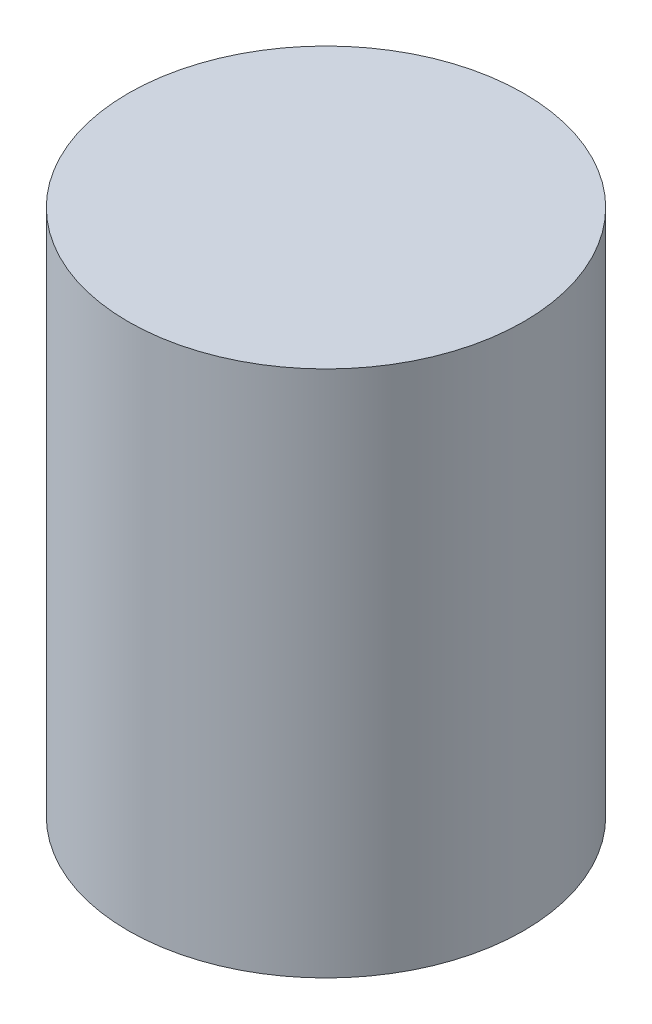
from build123d import *

# Parameters (mm, degrees)
SKETCH1_R           = 7.5
BOSS_EXTRUDE1_DEPTH = 20
SKETCH2_R           = 5
CUT_EXTRUDE1_DEPTH  = 4
CUT_EXTRUDE2_DEPTH  = 12
CHAMFER1_SIZE       = 1
CHAMFER1_SIZE2      = 0.577350269


with BuildPart() as part:
    # Sketch1 → Boss-Extrude1 (new body)
    with BuildSketch(Plane(origin=(0, 0, 0), x_dir=(1, 0, 0), z_dir=(0, 1, 0))):
        with Locations(Location((0, 0, 0), (0, 0, 270))):
            Circle(SKETCH1_R)
    extrude(amount=BOSS_EXTRUDE1_DEPTH)

    # Sketch2 → Cut-Extrude1 (cut)
    with BuildSketch(Plane.XZ):
        with Locations(Location((0, 0, 0), (0, 0, 270))):
            Circle(SKETCH2_R)
    extrude(amount=-CUT_EXTRUDE1_DEPTH, mode=Mode.SUBTRACT)

    # Sketch3 → Cut-Extrude2 (cut)
    with BuildSketch(Plane.XZ.offset(-4)):
        with BuildLine():
            Line((-1.732055507, -2.57098886), (3.04828024, -0.563903873))
            ThreePointArc((3.04828024, -0.563903873), (-1.200087257, 2.858284551), (-1.732055507, -2.57098886))
        make_face()
    extrude(amount=-CUT_EXTRUDE2_DEPTH, mode=Mode.SUBTRACT)

    # Chamfer1
    chamfer1_edges = [part.edges().sort_by_distance(p)[0] for p in [
        (0, 0, 5),
    ]]
    chamfer1_side = [part.faces().sort_by_distance(p)[0] for p in [
        (0, 2, 5),
    ]]
    chamfer(chamfer1_edges, length=CHAMFER1_SIZE, length2=CHAMFER1_SIZE2, reference=chamfer1_side[0])


solid = part.part
